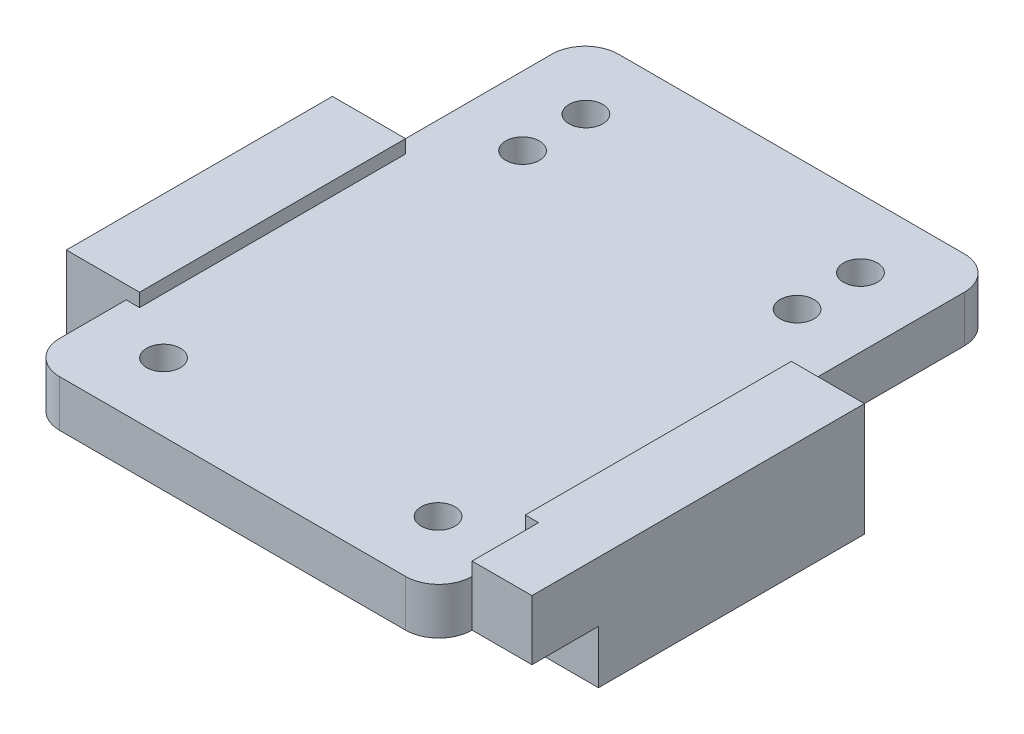
from build123d import *

# Parameters (mm, degrees)
SKETCH_2_W               = 62
SKETCH_2_H               = 84
EXTRUDE_1_DEPTH          = 7
CUT_EXTRUDE_1_DEPTH      = 53.668776329
CUT_EXTRUDE_1_DEPTH_BACK = 53.668776329
SKETCH_4_R               = 2.54
FILLET_1_R               = 5
FILLET_4_R               = 5
EXTRUDE_2_DEPTH          = 8
EXTRUDE_2_DEPTH_BACK     = 9
SKETCH_5_W               = 11
SKETCH_5_H               = 40
SKETCH_11_W              = 10
SKETCH_11_H              = 9
EXTRUDE_3_DEPTH          = 9


with BuildPart() as part:
    # 스케치2 → 보스-돌출1 (new body)
    with BuildSketch(Plane(origin=(0, 0, 0), x_dir=(1, 0, 0), z_dir=(0, 1, 0))):
        Rectangle(SKETCH_2_W, SKETCH_2_H)
    extrude(amount=EXTRUDE_1_DEPTH)

    # 스케치4 → 컷-돌출1 (cut, two sides: drawn at the far end of the back side and taken through both)
    with BuildSketch(Plane.XZ.offset(-CUT_EXTRUDE_1_DEPTH_BACK)):
        with Locations(Location((20.6375, 31.75, 0), (0, 0, 270))):
            Circle(SKETCH_4_R)
        with Locations(Location((20.6375, -22.225, 0), (0, 0, 270))):
            Circle(SKETCH_4_R)
        with Locations(Location((20.6375, -31.75, 0), (0, 0, 270))):
            Circle(SKETCH_4_R)
        with Locations(Location((-20.6375, -31.75, 0), (0, 0, 270))):
            Circle(SKETCH_4_R)
        with Locations(Location((-20.6375, -22.225, 0), (0, 0, 270))):
            Circle(SKETCH_4_R)
        with Locations(Location((-20.6375, 31.75, 0), (0, 0, 270))):
            Circle(SKETCH_4_R)
    extrude(amount=CUT_EXTRUDE_1_DEPTH + CUT_EXTRUDE_1_DEPTH_BACK, mode=Mode.SUBTRACT)

    # 필렛1
    fillet_1_edges = [part.edges().sort_by_distance(p)[0] for p in [
        (-31, 3.5, -42),
        (31, 3.5, -42),
    ]]
    fillet(fillet_1_edges, radius=FILLET_1_R)

    # 필렛4
    fillet_4_edges = [part.edges().sort_by_distance(p)[0] for p in [
        (31, 3.5, 42),
        (-31, 3.5, 42),
    ]]
    fillet(fillet_4_edges, radius=FILLET_4_R)

    # 스케치5 → 보스-돌출2 (add, two sides: drawn at the far end of the back side and taken through both)
    with BuildSketch(Plane.XZ.offset(-EXTRUDE_2_DEPTH_BACK)):
        with Locations((-34.5, 7)):
            Rectangle(SKETCH_5_W, SKETCH_5_H)
        with Locations((34.5, 7)):
            Rectangle(SKETCH_5_W, SKETCH_5_H)
    extrude(amount=EXTRUDE_2_DEPTH + EXTRUDE_2_DEPTH_BACK)

    # 스케치11 → 보스-돌출3 (add)
    with BuildSketch(Plane(origin=(31, 0, 0), x_dir=(0, 0, -1), z_dir=(1, 0, 0))):
        with Locations((-32, 4.5)):
            Rectangle(SKETCH_11_W, SKETCH_11_H)
    extrude(amount=EXTRUDE_3_DEPTH)


solid = part.part
